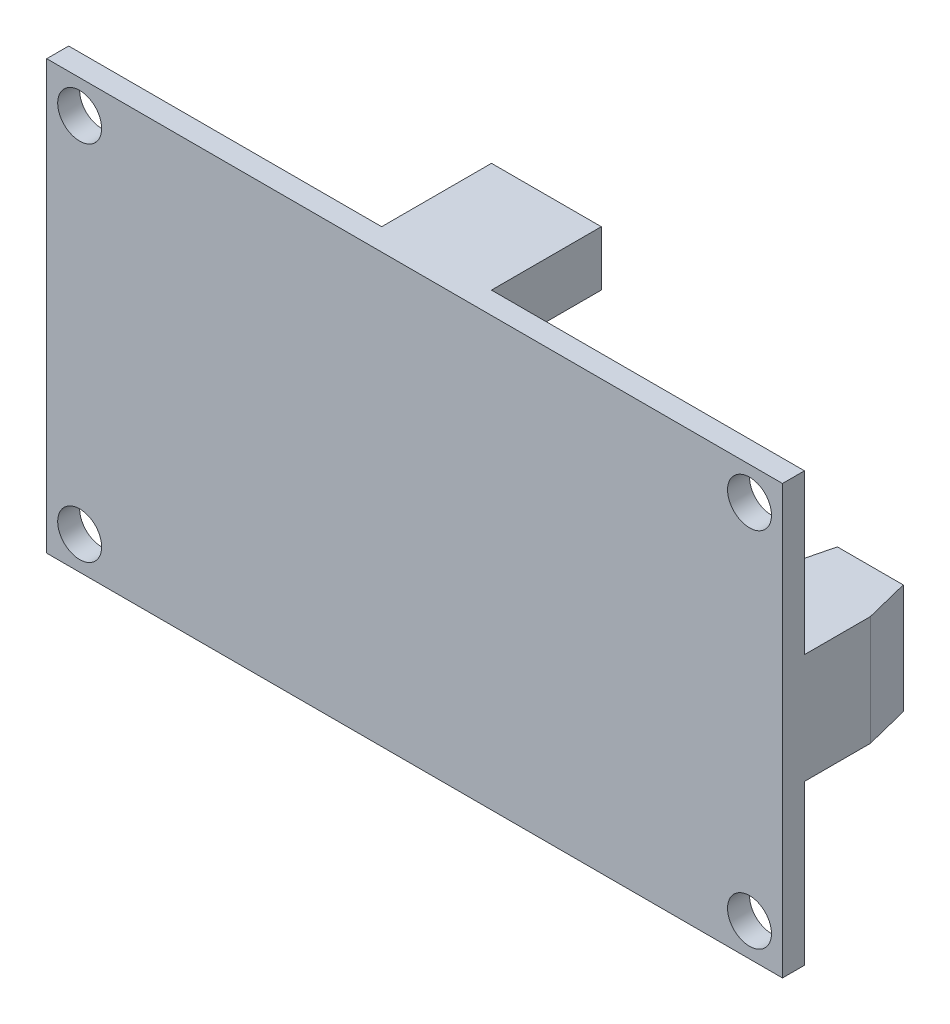
from build123d import *

# Parameters (mm, degrees)
SKETCH_1_W               = 67
SKETCH_1_H               = 39
EXTRUDE_1_DEPTH          = 2
SKETCH_2_R               = 2
CUT_EXTRUDE_1_DEPTH      = 2
MIRROR_2_COPY_1_SKETCH_R = 2
MIRROR_2_COPY_1_DEPTH    = 2
SKETCH_3_W               = 8
SKETCH_3_H               = 10
EXTRUDE_2_DEPTH          = 10
CUT_EXTRUDE_2_DEPTH      = 10
SKETCH_5_R               = 1.5
CUT_EXTRUDE_3_DEPTH      = 8
SKETCH_6_W               = 10
SKETCH_6_H               = 5
EXTRUDE_3_DEPTH          = 10
SKETCH_10_W              = 23
SKETCH_10_H              = 14
EXTRUDE_4_DEPTH          = 7.5


with BuildPart() as part:
    # 草图1 → 凸台-拉伸1 (new body)
    with BuildSketch(Plane.XY):
        Rectangle(SKETCH_1_W, SKETCH_1_H)
    extrude(amount=EXTRUDE_1_DEPTH)

    # 草图2 → 切除-拉伸1 (cut)
    with BuildSketch(Plane.XY.offset(2)):
        with Locations((-30.5, 16.5)):
            Circle(SKETCH_2_R)
    cut_extrude_1 = extrude(amount=-CUT_EXTRUDE_1_DEPTH, mode=Mode.SUBTRACT)

    # 镜向1: 切除-拉伸1 across plane
    add(cut_extrude_1.mirror(Plane(origin=(0, 0, 0), x_dir=(0, 0, 1), z_dir=(1, 0, 0))), mode=Mode.SUBTRACT)

    # 镜向2: 切除-拉伸1 across plane
    add(cut_extrude_1.mirror(Plane.ZX), mode=Mode.SUBTRACT)

    # 镜向2 copy 1 sketch → 镜向2 copy 1 (cut)
    with BuildSketch(Plane(origin=(0, 0, 2), x_dir=(-1, 0, 0), z_dir=(0, 0, 1))):
        with Locations((-30.5, 16.5)):
            Circle(MIRROR_2_COPY_1_SKETCH_R)
    extrude(amount=-MIRROR_2_COPY_1_DEPTH, mode=Mode.SUBTRACT)

    # 草图3 → 凸台-拉伸2 (add)
    with BuildSketch(Plane(origin=(0, 0, 0), x_dir=(-1, 0, 0), z_dir=(0, 0, -1))):
        with Locations((-29.5, 0)):
            Rectangle(SKETCH_3_W, SKETCH_3_H)
    extrude_2 = extrude(amount=EXTRUDE_2_DEPTH)

    # 草图4 → 切除-拉伸2 (cut)
    with BuildSketch(Plane.XZ.offset(5)):
        Polygon((32.5, -10), (33.5, -6), (33.5, -10), align=None)
        Polygon((25.5, -10), (25.5, -6), (26.5, -10), align=None)
    cut_extrude_2 = extrude(amount=-CUT_EXTRUDE_2_DEPTH, mode=Mode.SUBTRACT)

    # 草图5 → 切除-拉伸3 (cut)
    with BuildSketch(Plane(origin=(0, 0, -10), x_dir=(-1, 0, 0), z_dir=(0, 0, -1))):
        with Locations((-29.5, 2)):
            Circle(SKETCH_5_R)
        with Locations((-29.5, -2)):
            Circle(SKETCH_5_R)
    cut_extrude_3 = extrude(amount=-CUT_EXTRUDE_3_DEPTH, mode=Mode.SUBTRACT)

    # 镜向3: 凸台-拉伸2, 切除-拉伸2, 切除-拉伸3 across plane
    add(extrude_2.mirror(Plane(origin=(0, 0, 0), x_dir=(0, 0, 1), z_dir=(1, 0, 0))))
    add(cut_extrude_2.mirror(Plane(origin=(0, 0, 0), x_dir=(0, 0, 1), z_dir=(1, 0, 0))), mode=Mode.SUBTRACT)
    add(cut_extrude_3.mirror(Plane(origin=(0, 0, 0), x_dir=(0, 0, 1), z_dir=(1, 0, 0))), mode=Mode.SUBTRACT)

    # 草图6 → 凸台-拉伸3 (add)
    with BuildSketch(Plane(origin=(0, 0, 0), x_dir=(-1, 0, 0), z_dir=(0, 0, -1))):
        with Locations((0, 17)):
            Rectangle(SKETCH_6_W, SKETCH_6_H)
    extrude(amount=EXTRUDE_3_DEPTH)

    # 草图10 → 凸台-拉伸4 (add)
    with BuildSketch(Plane(origin=(0, 0, 0), x_dir=(-1, 0, 0), z_dir=(0, 0, -1))):
        with Locations((0, -12.5)):
            Rectangle(SKETCH_10_W, SKETCH_10_H)
    extrude(amount=EXTRUDE_4_DEPTH)


solid = part.part
